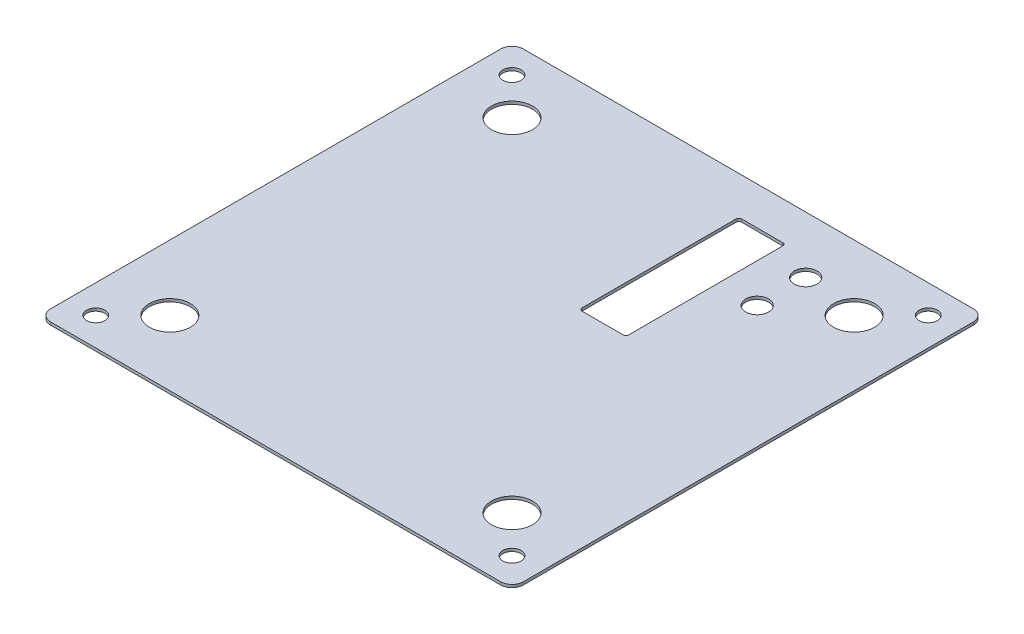
from build123d import *

# Parameters (mm, degrees)
SKETCH1_W           = 82.9
SKETCH1_H           = 82.9
BOSS_EXTRUDE1_DEPTH = 0.5
SKETCH2_R           = 3.6
CUT_EXTRUDE1_DEPTH  = 59.62128453
FILLET1_R           = 2
SKETCH3_R           = 1.6
CUT_EXTRUDE2_DEPTH  = 10
SKETCH4_R           = 2
CUT_EXTRUDE3_DEPTH  = 10
SKETCH7_W           = 8.2
SKETCH7_H           = 28
CUT_EXTRUDE5_DEPTH  = 10
FILLET3_R           = 0.5


with BuildPart() as part:
    # Sketch1 → Boss-Extrude1 (new body)
    with BuildSketch(Plane(origin=(0, 0, 0), x_dir=(1, 0, 0), z_dir=(0, 1, 0))):
        Rectangle(SKETCH1_W, SKETCH1_H)
    extrude(amount=BOSS_EXTRUDE1_DEPTH)

    # Sketch2 → Cut-Extrude1 (cut, through all)
    with BuildSketch(Plane(origin=(0, 0.5, 0), x_dir=(1, 0, 0), z_dir=(0, 1, 0))):
        with Locations(Location((-30, 30, 0), (0, 0, 270))):
            Circle(SKETCH2_R)
        with Locations(Location((30, 30, 0), (0, 0, 270))):
            Circle(SKETCH2_R)
        with Locations(Location((30, -30, 0), (0, 0, 270))):
            Circle(SKETCH2_R)
        with Locations(Location((-30, -30, 0), (0, 0, 270))):
            Circle(SKETCH2_R)
    extrude(amount=-CUT_EXTRUDE1_DEPTH, mode=Mode.SUBTRACT)

    # Fillet1
    fillet1_edges = [part.edges().sort_by_distance(p)[0] for p in [
        (41.45, 0.25, 41.45),
        (-41.45, 0.25, 41.45),
        (-41.45, 0.25, -41.45),
        (41.45, 0.25, -41.45),
    ]]
    fillet(fillet1_edges, radius=FILLET1_R)

    # Sketch3 → Cut-Extrude2 (cut)
    with BuildSketch(Plane(origin=(0, 0.5, 0), x_dir=(1, 0, 0), z_dir=(0, 1, 0))):
        with Locations(Location((-36.5, 36.5, 0), (0, 0, 270))):
            Circle(SKETCH3_R)
        with Locations(Location((36.5, 36.5, 0), (0, 0, 270))):
            Circle(SKETCH3_R)
        with Locations(Location((36.5, -36.5, 0), (0, 0, 270))):
            Circle(SKETCH3_R)
        with Locations(Location((-36.5, -36.5, 0), (0, 0, 270))):
            Circle(SKETCH3_R)
    extrude(amount=-CUT_EXTRUDE2_DEPTH, mode=Mode.SUBTRACT)

    # Sketch4 → Cut-Extrude3 (cut)
    with BuildSketch(Plane(origin=(0, 0.5, 0), x_dir=(1, 0, 0), z_dir=(0, 1, 0))):
        with Locations(Location((19.999999567, 31.499795659, 0), (0, 0, 270))):
            Circle(SKETCH4_R)
        with Locations(Location((19.999999567, 22.999799474, 0), (0, 0, 270))):
            Circle(SKETCH4_R)
    extrude(amount=-CUT_EXTRUDE3_DEPTH, mode=Mode.SUBTRACT)

    # Sketch7 → Cut-Extrude5 (cut)
    with BuildSketch(Plane(origin=(0, 0.5, 0), x_dir=(1, 0, 0), z_dir=(0, 1, 0))):
        with Locations((9.09999852, 20.7799998)):
            Rectangle(SKETCH7_W, SKETCH7_H)
    extrude(amount=-CUT_EXTRUDE5_DEPTH, mode=Mode.SUBTRACT)

    # Fillet3
    fillet3_edges = [part.edges().sort_by_distance(p)[0] for p in [
        (13.19999852, 0.25, -34.7799998),
        (13.19999852, 0.25, -6.7799998),
        (4.99999852, 0.25, -6.7799998),
        (4.99999852, 0.25, -34.7799998),
    ]]
    fillet(fillet3_edges, radius=FILLET3_R)


solid = part.part
